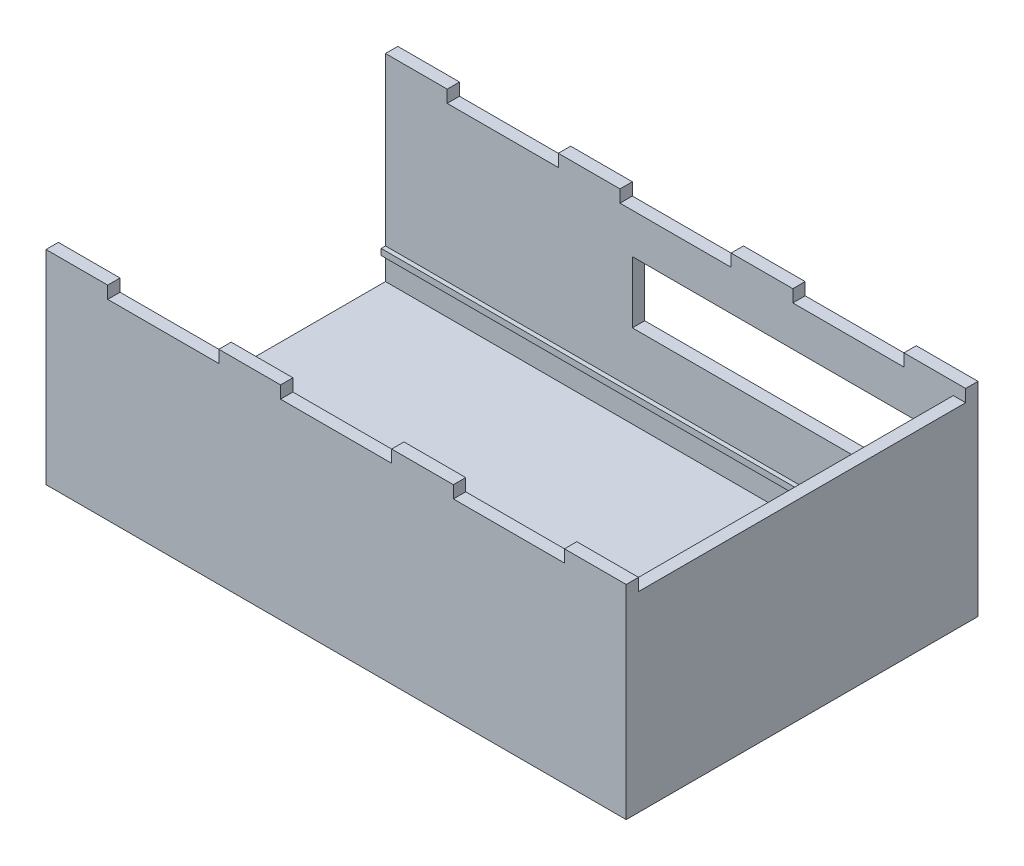
from build123d import *

# Parameters (mm, degrees)
SKETCH1_W           = 94
SKETCH1_H           = 57
BOSS_EXTRUDE1_DEPTH = 1
BOSS_EXTRUDE3_DEPTH = 30
SKETCH5_W           = 0.7
SKETCH5_H           = 1
BOSS_EXTRUDE4_DEPTH = 92
SKETCH6_W           = 47
SKETCH6_H           = 10
CUT_EXTRUDE2_DEPTH  = 30
SKETCH7_W           = 10
SKETCH7_H           = 2
BOSS_EXTRUDE5_DEPTH = 2


with BuildPart() as part:
    # Sketch1 → Boss-Extrude1 (new body)
    with BuildSketch(Plane(origin=(0, 0, 0), x_dir=(1, 0, 0), z_dir=(0, 1, 0))):
        with Locations((-9.450515464, -3.911340206)):
            Rectangle(SKETCH1_W, SKETCH1_H)
    extrude(amount=BOSS_EXTRUDE1_DEPTH)

    # Sketch2 → Boss-Extrude3 (add)
    with BuildSketch(Plane(origin=(0, 1, 0), x_dir=(1, 0, 0), z_dir=(0, 1, 0))):
        Polygon((-56.450515464, 24.588659794), (37.549484536, 24.588659794), (37.549484536, -32.411340206), (-56.450515464, -32.411340206), (-56.450515464, -30.411340206), (-54.450515464, -30.411340206), (35.549484536, -30.411340206), (35.549484536, 22.588659794), (-54.450515464, 22.588659794), (-56.450515464, 22.588659794), align=None)
    extrude(amount=BOSS_EXTRUDE3_DEPTH)

    # Sketch5 → Boss-Extrude4 (add)
    with BuildSketch(Plane.ZY.offset(56.450515464)):
        with Locations((-22.238659794, 5.5)):
            Rectangle(SKETCH5_W, SKETCH5_H)
        with Locations((30.061340206, 5.5)):
            Rectangle(SKETCH5_W, SKETCH5_H)
    extrude(amount=-BOSS_EXTRUDE4_DEPTH)

    # Sketch6 → Cut-Extrude2 (cut)
    with BuildSketch(Plane(origin=(0, 0, -24.588659794), x_dir=(-1, 0, 0), z_dir=(0, 0, -1))):
        with Locations((-7.049484536, 19.5)):
            Rectangle(SKETCH6_W, SKETCH6_H)
    extrude(amount=-CUT_EXTRUDE2_DEPTH, mode=Mode.SUBTRACT)

    # Sketch7 → Boss-Extrude5 (add)
    with BuildSketch(Plane(origin=(0, 31, 0), x_dir=(1, 0, 0), z_dir=(0, 1, 0))):
        with Locations((-51.450515464, 23.588659794)):
            Rectangle(SKETCH7_W, SKETCH7_H)
        with Locations((-23.450515464, 23.588659794)):
            Rectangle(SKETCH7_W, SKETCH7_H)
        with Locations((4.549484536, 23.588659794)):
            Rectangle(SKETCH7_W, SKETCH7_H)
        with Locations((32.549484536, 23.588659794)):
            Rectangle(SKETCH7_W, SKETCH7_H)
        with Locations((-51.450515464, -31.411340206)):
            Rectangle(SKETCH7_W, SKETCH7_H)
        with Locations((-23.450515464, -31.411340206)):
            Rectangle(SKETCH7_W, SKETCH7_H)
        with Locations((4.549484536, -31.411340206)):
            Rectangle(SKETCH7_W, SKETCH7_H)
        with Locations((32.549484536, -31.411340206)):
            Rectangle(SKETCH7_W, SKETCH7_H)
    extrude(amount=BOSS_EXTRUDE5_DEPTH)


solid = part.part
